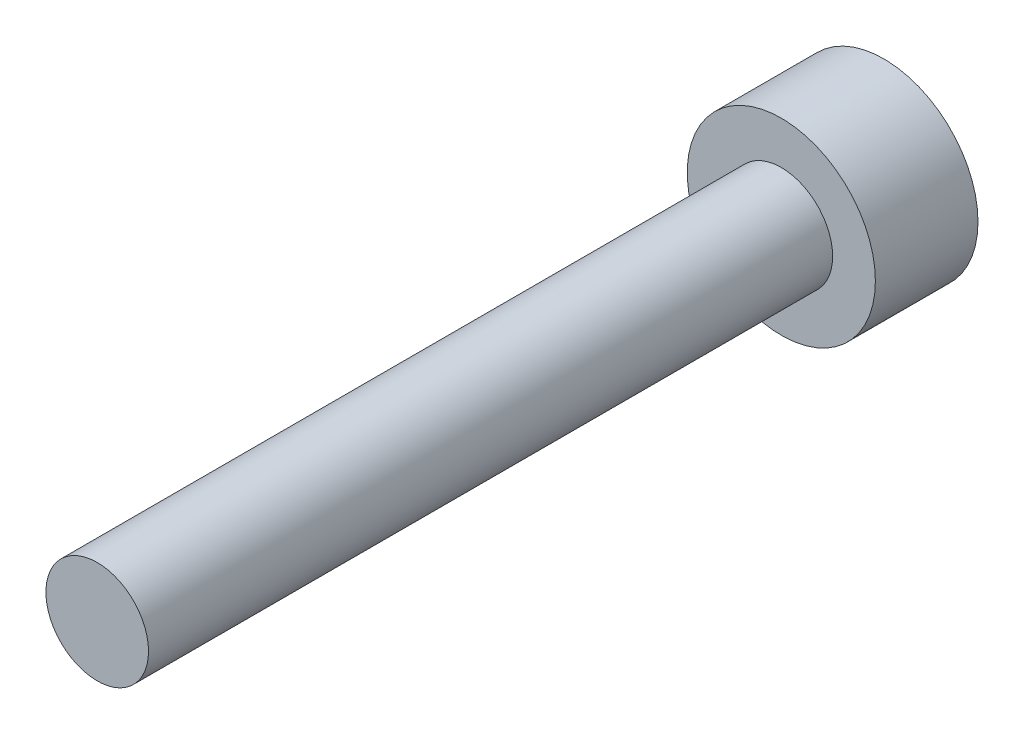
from build123d import *

# Parameters (mm, degrees)
CABEZA_START            = -3
CROQUIS1_R              = 2.75
CABEZA_DEPTH            = 3
CROQUIS2_R              = 1.5
CUERPO_DEPTH            = 20
HEXAGONO_INTERIOR_START = -3
HEXAGONO_INTERIOR_DEPTH = 1.3


with BuildPart() as part:
    # Croquis1 → Cabeza (new body)
    with BuildSketch(Plane.XY.offset(CABEZA_START)):
        Circle(CROQUIS1_R)
    extrude(amount=CABEZA_DEPTH)

    # Croquis2 → Cuerpo (add)
    with BuildSketch(Plane.XY):
        Circle(CROQUIS2_R)
    extrude(amount=CUERPO_DEPTH)

    # Croquis3 → Hexagono_interior (cut)
    with BuildSketch(Plane.XY.offset(HEXAGONO_INTERIOR_START)):
        Polygon((1.443375673, 0), (0.721687836, 1.25), (-0.721687836, 1.25), (-1.443375673, 0), (-0.721687836, -1.25), (0.721687836, -1.25), align=None)
    extrude(amount=HEXAGONO_INTERIOR_DEPTH, mode=Mode.SUBTRACT)


solid = part.part
